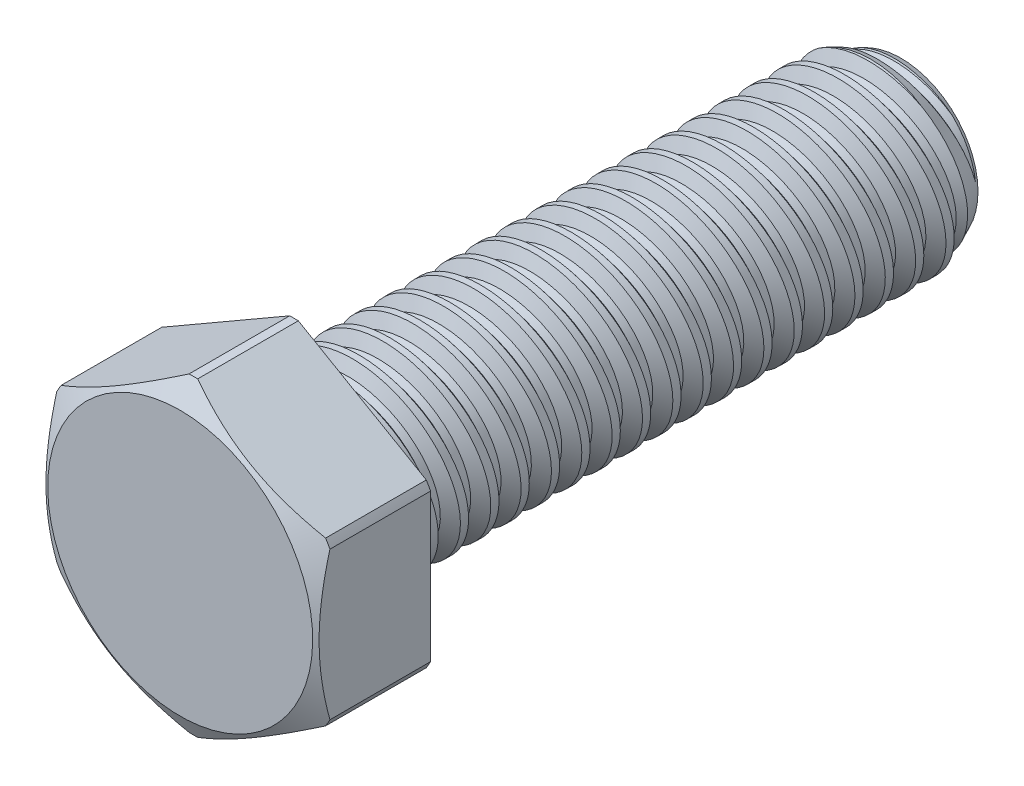
from build123d import *

# Parameters (mm, degrees)
SKETCH1_W            = 31.75
SKETCH1_H            = 4.7625
LPATTERN1_COUNT      = 2
LPATTERN1_PITCH      = 1.5875
LPATTERN1_COUNT_DIR2 = 20
LPATTERN1_PITCH_DIR2 = 1.5875
EXTRUDE1_DEPTH       = 5.953125


with BuildPart() as part:
    # Sketch1 → Revolve1 (revolve)
    with BuildSketch(Plane(origin=(0, 0, 0), x_dir=(0, 0, -1), z_dir=(1, 0, 0)), mode=Mode.PRIVATE) as revolve1_sk:
        with Locations((0, 2.38125)):
            Rectangle(SKETCH1_W, SKETCH1_H)
    revolve(revolve1_sk.sketch.rotate(Axis((0, 0, 15.875), (0, 0, 1)), 124.561991019), axis=Axis((0, 0, 15.875), (0, 0, 1)))

    # Sketch2 → Cut-Revolve1 (revolve, cut)
    with BuildSketch(Plane(origin=(0, 0, 0), x_dir=(0, 0, -1), z_dir=(1, 0, 0)), mode=Mode.PRIVATE) as cut_revolve1_sk:
        Polygon((-14.309099646, 5.023483392), (-15.679262456, 4.795122924), (-15.04865719, 4.029111805), (-14.657182102, 4.094357653), align=None)
    cut_revolve1 = revolve(cut_revolve1_sk.sketch.rotate(Axis((0, -0.28317269, 15.875), (0, 0.1643989873053576, -0.9863939238321437)), 180), axis=Axis((0, -0.28317269, 15.875), (0, 0.1643989873053576, -0.9863939238321437)), mode=Mode.SUBTRACT)

    # Sketch3 → Cut-Revolve2 (revolve, cut)
    with BuildSketch(Plane(origin=(0, 0, 0), x_dir=(0, 0, -1), z_dir=(1, 0, 0)), mode=Mode.PRIVATE) as cut_revolve2_sk:
        Polygon((14.302243941, 4.7625), (15.875, 4.029111805), (15.875, 4.7625), align=None)
    revolve(cut_revolve2_sk.sketch.rotate(Axis((0, 0, 0), (0, 0, -1)), 235.438008981), axis=Axis((0, 0, 0), (0, 0, -1)), mode=Mode.SUBTRACT)

    # LPattern1: Cut-Revolve1 2 × 20
    with Locations(*[Vector(0, 0, 1) * (i * LPATTERN1_PITCH) + Vector(0, 0, -1) * (j * LPATTERN1_PITCH_DIR2) for i in range(LPATTERN1_COUNT) for j in range(LPATTERN1_COUNT_DIR2) if (i, j) != (0, 0)]):
        add(cut_revolve1, mode=Mode.SUBTRACT)

    # Sketch5 → Extrude1 (add)
    with BuildSketch(Plane.XY.offset(15.875)):
        Polygon((0, 8.248891971), (-7.14375, 4.124445986), (-7.14375, -4.124445986), (0, -8.248891971), (7.14375, -4.124445986), (7.14375, 4.124445986), align=None)
    extrude(amount=EXTRUDE1_DEPTH)

    # Sketch6 → Cut-Revolve3 (revolve, cut)
    with BuildSketch(Plane(origin=(0, 0, 0), x_dir=(0, 0, -1), z_dir=(1, 0, 0)), mode=Mode.PRIVATE) as cut_revolve3_sk:
        Polygon((-21.828125, 6.9294375), (-21.13966109, 8.121891971), (-15.875, 8.121891971), (-15.875, 8.629891971), (-21.828125, 8.629891971), align=None)
    revolve(cut_revolve3_sk.sketch.rotate(Axis((0, 0, 0), (0, 0, 1)), 327.846603581), axis=Axis((0, 0, 0), (0, 0, 1)), mode=Mode.SUBTRACT)


solid = part.part
